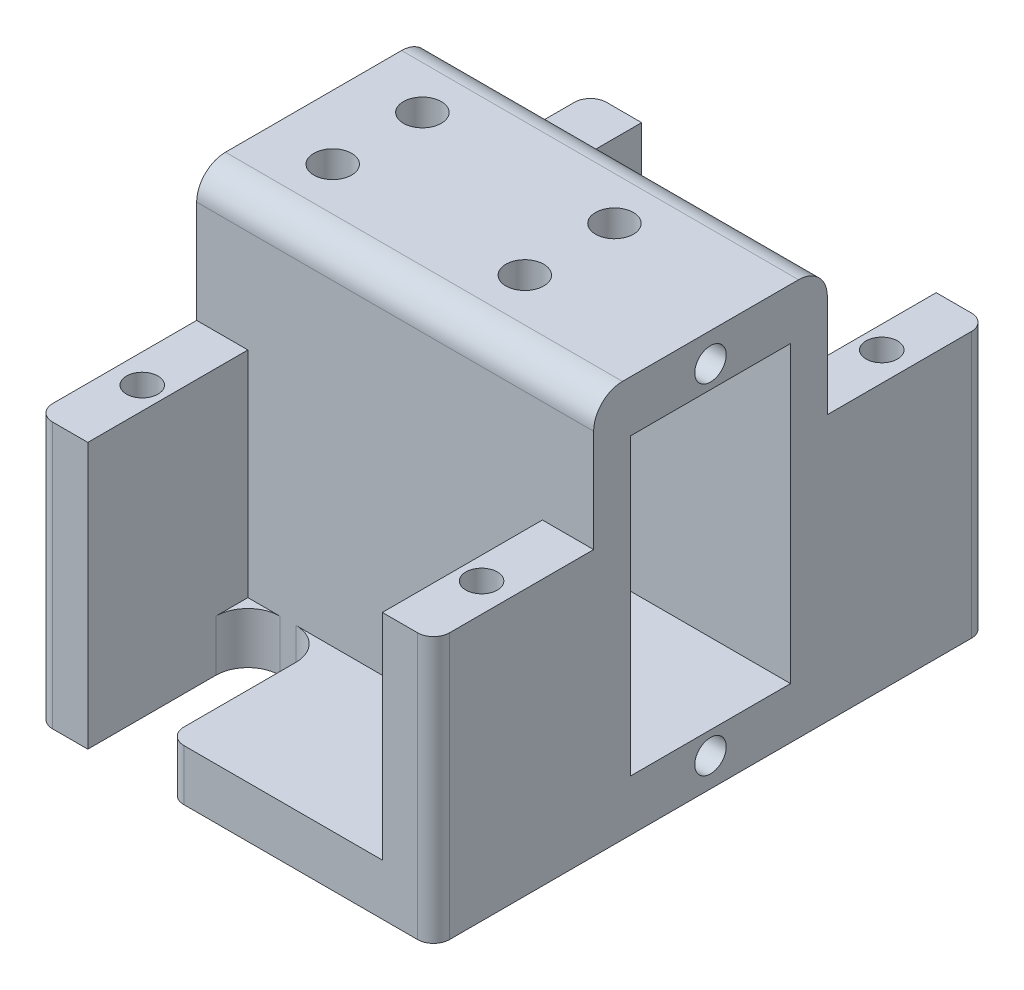
from build123d import *

# Parameters (mm, degrees)
SKETCH1_R           = 1.25
BOSS_EXTRUDE1_DEPTH = 4.064
FILLET1_R           = 2.54
SKETCH1_5_W         = 4.064
SKETCH1_5_H         = 12.7
SKETCH1_5_R         = 1.25
SKETCH1_5_H_2       = 2.921
BOSS_EXTRUDE2_DEPTH = 21.082
SKETCH1_7_W         = 4.064
SKETCH1_7_H         = 2.921
SKETCH1_7_W_2       = 23.368
SKETCH1_7_H_2       = 12.7
BOSS_EXTRUDE3_DEPTH = 31.496
SKETCH1_9_W         = 23.368
SKETCH1_9_H         = 12.7
SKETCH1_9_W_2       = 4.064
CUT_EXTRUDE1_DEPTH  = 27.432
SKETCH1_10_W        = 23.368
SKETCH1_10_H        = 12.7
SKETCH1_10_W_2      = 4.064
BOSS_EXTRUDE4_DEPTH = 4.064
SKETCH2_R           = 1.25
CUT_EXTRUDE2_DEPTH  = 12.7
SKETCH2_3_W         = 12.7
SKETCH2_3_H         = 6.35
CUT_EXTRUDE3_DEPTH  = 40.132
FILLET2_R           = 3.81
FILLET3_R           = 1.27
SKETCH3_R           = 1.5
CUT_EXTRUDE4_DEPTH  = 19.304
FILLET4_R           = 2.286


with BuildPart() as part:
    # Sketch1 → Boss-Extrude1 (new body)
    with BuildSketch(Plane(origin=(0, 0, 0), x_dir=(1, 0, 0), z_dir=(0, 1, 0))):
        Polygon((29.21, 6.096), (8.128, 6.096), (8.128, -6.604), (1.778, -6.604), (1.778, 6.096), (-2.286, 6.096), (-2.286, -37.846), (1.778, -37.846), (1.778, -25.146), (8.128, -25.146), (8.128, -37.846), (29.21, -37.846), align=None)
        with Locations(Location((26.924, 0, 0), (0, 0, 270))):
            Circle(SKETCH1_R, mode=Mode.SUBTRACT)
        with Locations(Location((0, 0, 0), (0, 0, 270))):
            Circle(SKETCH1_R, mode=Mode.SUBTRACT)
        with Locations(Location((26.924, -31.75, 0), (0, 0, 270))):
            Circle(SKETCH1_R, mode=Mode.SUBTRACT)
        with Locations(Location((0, -31.75, 0), (0, 0, 270))):
            Circle(SKETCH1_R, mode=Mode.SUBTRACT)
    extrude(amount=BOSS_EXTRUDE1_DEPTH)

    # Fillet1
    fillet1_edges = [part.edges().sort_by_distance(p)[0] for p in [
        (8.128, 2.032, 25.146),
        (1.778, 2.032, 25.146),
        (1.778, 2.032, 6.604),
        (8.128, 2.032, 6.604),
    ]]
    fillet(fillet1_edges, radius=FILLET1_R)

    # Sketch1<5> → Boss-Extrude2 (add)
    # profile 1 of 9: a face of its own
    with BuildSketch(Plane(origin=(0, 0, 0), x_dir=(1, 0, 0), z_dir=(0, 1, 0))):
        Polygon((1.778, -22.225), (1.778, -9.525), (1.778, -6.604), (-2.286, -6.604), (-2.286, -25.146), (1.778, -25.146), align=None)
    # profile 2 of 9: a face of its own
    with BuildSketch(Plane(origin=(0, 0, 0), x_dir=(1, 0, 0), z_dir=(0, 1, 0))):
        with Locations((-0.254, -31.496)):
            Rectangle(SKETCH1_5_W, SKETCH1_5_H)
        with Locations(Location((0, -31.75, 0), (0, 0, 270))):
            Circle(SKETCH1_5_R, mode=Mode.SUBTRACT)
    # profile 3 of 9: a face of its own
    with BuildSketch(Plane(origin=(0, 0, 0), x_dir=(1, 0, 0), z_dir=(0, 1, 0))):
        with Locations((-0.254, -0.254)):
            Rectangle(SKETCH1_5_W, SKETCH1_5_H)
        with Locations(Location((0, 0, 0), (0, 0, 270))):
            Circle(SKETCH1_5_R, mode=Mode.SUBTRACT)
    # profile 4 of 9: a face of its own
    with BuildSketch(Plane(origin=(0, 0, 0), x_dir=(1, 0, 0), z_dir=(0, 1, 0))):
        Polygon((25.146, -25.146), (25.146, -22.225), (1.778, -22.225), (1.778, -25.146), (8.128, -25.146), align=None)
    # profile 5 of 9: a face of its own
    with BuildSketch(Plane(origin=(0, 0, 0), x_dir=(1, 0, 0), z_dir=(0, 1, 0))):
        Polygon((25.146, -9.525), (25.146, -6.604), (8.128, -6.604), (1.778, -6.604), (1.778, -9.525), align=None)
    # profile 6 of 9: a face of its own
    with BuildSketch(Plane(origin=(0, 0, 0), x_dir=(1, 0, 0), z_dir=(0, 1, 0))):
        with Locations((27.178, -8.0645)):
            Rectangle(SKETCH1_5_W, SKETCH1_5_H_2)
    # profile 7 of 9: a face of its own
    with BuildSketch(Plane(origin=(0, 0, 0), x_dir=(1, 0, 0), z_dir=(0, 1, 0))):
        with Locations((27.178, -23.6855)):
            Rectangle(SKETCH1_5_W, SKETCH1_5_H_2)
    # profile 8 of 9: a face of its own
    with BuildSketch(Plane(origin=(0, 0, 0), x_dir=(1, 0, 0), z_dir=(0, 1, 0))):
        with Locations((27.178, -31.496)):
            Rectangle(SKETCH1_5_W, SKETCH1_5_H)
        with Locations(Location((26.924, -31.75, 0), (0, 0, 270))):
            Circle(SKETCH1_5_R, mode=Mode.SUBTRACT)
    # profile 9 of 9: a face of its own
    with BuildSketch(Plane(origin=(0, 0, 0), x_dir=(1, 0, 0), z_dir=(0, 1, 0))):
        with Locations((27.178, -0.254)):
            Rectangle(SKETCH1_5_W, SKETCH1_5_H)
        with Locations(Location((26.924, 0, 0), (0, 0, 270))):
            Circle(SKETCH1_5_R, mode=Mode.SUBTRACT)
    extrude(amount=BOSS_EXTRUDE2_DEPTH)

    # Sketch1<7> → Boss-Extrude3 (add)
    with BuildSketch(Plane(origin=(0, 0, 0), x_dir=(1, 0, 0), z_dir=(0, 1, 0))):
        with Locations((27.178, -8.0645)):
            Rectangle(SKETCH1_7_W, SKETCH1_7_H)
        Polygon((25.146, -9.525), (25.146, -6.604), (8.128, -6.604), (1.778, -6.604), (1.778, -9.525), align=None)
        with Locations((27.178, -23.6855)):
            Rectangle(SKETCH1_7_W, SKETCH1_7_H)
        with Locations((13.462, -15.875)):
            Rectangle(SKETCH1_7_W_2, SKETCH1_7_H_2)
        with Locations((27.178, -15.875)):
            Rectangle(SKETCH1_7_W, SKETCH1_7_H_2)
        Polygon((25.146, -25.146), (25.146, -22.225), (1.778, -22.225), (1.778, -25.146), (8.128, -25.146), align=None)
        Polygon((1.778, -22.225), (1.778, -9.525), (1.778, -6.604), (-2.286, -6.604), (-2.286, -25.146), (1.778, -25.146), align=None)
    extrude(amount=BOSS_EXTRUDE3_DEPTH)

    # Sketch1<9> → Cut-Extrude1 (cut)
    with BuildSketch(Plane(origin=(0, 0, 0), x_dir=(1, 0, 0), z_dir=(0, 1, 0))):
        with Locations((13.462, -15.875)):
            Rectangle(SKETCH1_9_W, SKETCH1_9_H)
        with Locations((27.178, -15.875)):
            Rectangle(SKETCH1_9_W_2, SKETCH1_9_H)
    extrude(amount=CUT_EXTRUDE1_DEPTH, mode=Mode.SUBTRACT)

    # Sketch1<10> → Boss-Extrude4 (add)
    with BuildSketch(Plane(origin=(0, 0, 0), x_dir=(1, 0, 0), z_dir=(0, 1, 0))):
        with Locations((13.462, -15.875)):
            Rectangle(SKETCH1_10_W, SKETCH1_10_H)
        with Locations((27.178, -15.875)):
            Rectangle(SKETCH1_10_W_2, SKETCH1_10_H)
    extrude(amount=BOSS_EXTRUDE4_DEPTH)

    # Sketch2 → Cut-Extrude2 (cut)
    with BuildSketch(Plane(origin=(29.21, 0, 0), x_dir=(0, 0, -1), z_dir=(1, 0, 0))):
        with Locations((-15.875, 29.21)):
            Circle(SKETCH2_R)
        with Locations((-15.875, 2.286)):
            Circle(SKETCH2_R)
    extrude(amount=-CUT_EXTRUDE2_DEPTH, mode=Mode.SUBTRACT)

    # Sketch2<3> → Cut-Extrude3 (cut)
    with BuildSketch(Plane(origin=(29.21, 0, 0), x_dir=(0, 0, -1), z_dir=(1, 0, 0))):
        with Locations((-15.875, 24.257)):
            Rectangle(SKETCH2_3_W, SKETCH2_3_H)
        with Locations((-15.875, 7.239)):
            Rectangle(SKETCH2_3_W, SKETCH2_3_H)
    extrude(amount=-CUT_EXTRUDE3_DEPTH, mode=Mode.SUBTRACT)

    # Fillet2
    fillet2_edges = [part.edges().sort_by_distance(p)[0] for p in [
        (-0.254, 21.082, 9.525),
        (-0.254, 21.082, 22.225),
        (-0.254, 10.414, 22.225),
        (-0.254, 10.414, 9.525),
    ]]
    fillet(fillet2_edges, radius=FILLET2_R)

    # Fillet3
    fillet3_edges = [part.edges().sort_by_distance(p)[0] for p in [
        (29.21, 10.541, 37.846),
        (8.128, 2.032, 37.846),
        (-2.286, 10.541, 37.846),
        (-2.286, 10.541, -6.096),
        (8.128, 2.032, -6.096),
        (29.21, 10.541, -6.096),
    ]]
    fillet(fillet3_edges, radius=FILLET3_R)

    # Sketch3 → Cut-Extrude4 (cut)
    with BuildSketch(Plane(origin=(0, 31.496, 0), x_dir=(1, 0, 0), z_dir=(0, 1, 0))):
        with Locations(Location((2.794, -12.319, 0), (0, 0, 270))):
            Circle(SKETCH3_R)
        with Locations(Location((18.034, -12.319, 0), (0, 0, 270))):
            Circle(SKETCH3_R)
        with Locations(Location((2.794, -19.431, 0), (0, 0, 270))):
            Circle(SKETCH3_R)
        with Locations(Location((18.034, -19.431, 0), (0, 0, 270))):
            Circle(SKETCH3_R)
    extrude(amount=-CUT_EXTRUDE4_DEPTH, mode=Mode.SUBTRACT)

    # Fillet4
    fillet4_edges = [part.edges().sort_by_distance(p)[0] for p in [
        (13.462, 31.496, 6.604),
        (13.462, 31.496, 25.146),
    ]]
    fillet(fillet4_edges, radius=FILLET4_R)


solid = part.part
